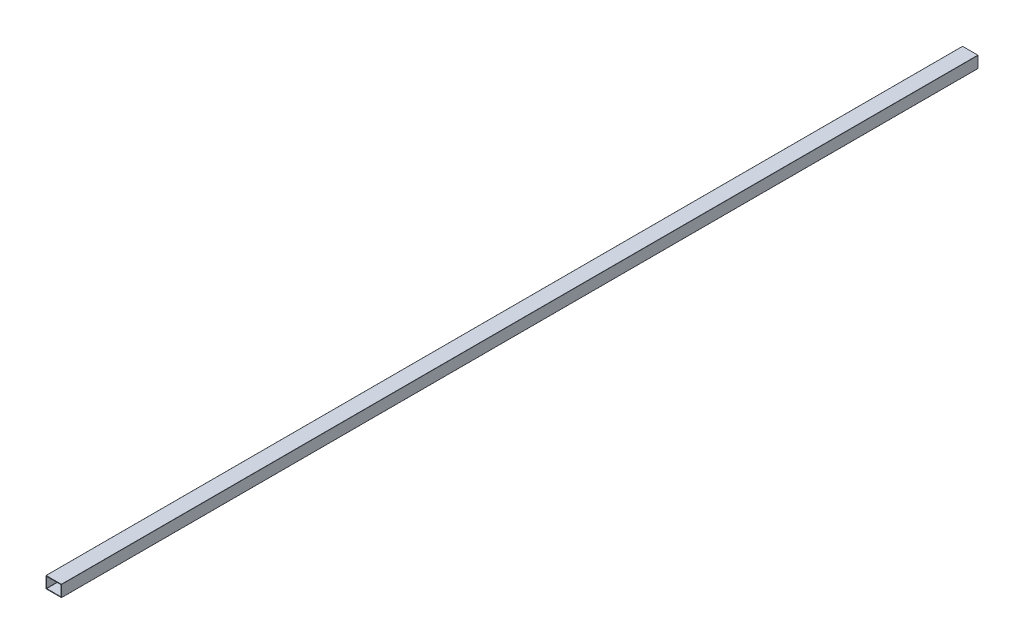
from build123d import *

# Parameters (mm, degrees)
CROQUIS1_W              = 101.6
CROQUIS1_H              = 76.2
CROQUIS1_W_2            = 94
CROQUIS1_H_2            = 68.6
SALIENTE_EXTRUIR1_DEPTH = 6000
REDONDEO1_R             = 1


with BuildPart() as part:
    # Croquis1 → Saliente-Extruir1 (new body)
    with BuildSketch(Plane.XY):
        Rectangle(CROQUIS1_W, CROQUIS1_H)
        Rectangle(CROQUIS1_W_2, CROQUIS1_H_2, mode=Mode.SUBTRACT)
    extrude(amount=-SALIENTE_EXTRUIR1_DEPTH)

    # Redondeo1
    redondeo1_edges = [part.edges().sort_by_distance(p)[0] for p in [
        (47, -34.3, -3000),
        (-47, -34.3, -3000),
        (-47, 34.3, -3000),
        (47, 34.3, -3000),
        (50.8, -38.1, -3000),
        (-50.8, -38.1, -3000),
        (-50.8, 38.1, -3000),
        (50.8, 38.1, -3000),
    ]]
    fillet(redondeo1_edges, radius=REDONDEO1_R)


solid = part.part
